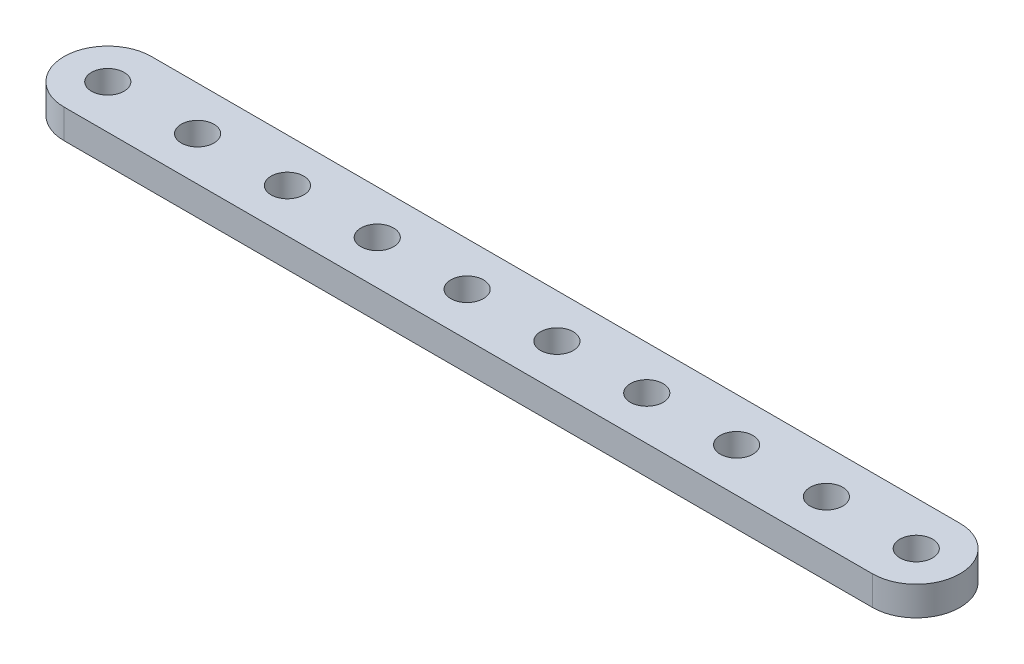
from build123d import *

# Parameters (mm, degrees)
SKETCH1_R           = 1.778
BOSS_EXTRUDE1_DEPTH = 6.35
CUT_EXTRUDE1_DEPTH  = 55.241416026
SKETCH3_W           = 123.961526382
SKETCH3_H           = 57.130094768
CUT_EXTRUDE2_DEPTH  = 3.175


with BuildPart() as part:
    # Sketch1 → Boss-Extrude1 (new body)
    with BuildSketch(Plane.XZ):
        with BuildLine():
            Line((-48.895, -4.7625), (48.895, -4.7625))
            ThreePointArc((48.895, -4.7625), (53.6575, 0), (48.895, 4.7625))
            Line((48.895, 4.7625), (-48.895, 4.7625))
            ThreePointArc((-48.895, 4.7625), (-53.6575, 0), (-48.895, -4.7625))
        make_face()
        with Locations(Location((48.895, 0, 0), (0, 0, 270))):
            Circle(SKETCH1_R, mode=Mode.SUBTRACT)
        with Locations(Location((39.116, 0, 0), (0, 0, 270))):
            Circle(SKETCH1_R, mode=Mode.SUBTRACT)
        with Locations(Location((29.337, 0, 0), (0, 0, 270))):
            Circle(SKETCH1_R, mode=Mode.SUBTRACT)
        with Locations(Location((19.558, 0, 0), (0, 0, 270))):
            Circle(SKETCH1_R, mode=Mode.SUBTRACT)
        with Locations(Location((9.779, 0, 0), (0, 0, 270))):
            Circle(SKETCH1_R, mode=Mode.SUBTRACT)
        with Locations(Location((0, 0, 0), (0, 0, 270))):
            Circle(SKETCH1_R, mode=Mode.SUBTRACT)
        with Locations(Location((-9.779, 0, 0), (0, 0, 270))):
            Circle(SKETCH1_R, mode=Mode.SUBTRACT)
        with Locations(Location((-19.558, 0, 0), (0, 0, 270))):
            Circle(SKETCH1_R, mode=Mode.SUBTRACT)
        with Locations(Location((-29.337, 0, 0), (0, 0, 270))):
            Circle(SKETCH1_R, mode=Mode.SUBTRACT)
        with Locations(Location((-39.116, 0, 0), (0, 0, 270))):
            Circle(SKETCH1_R, mode=Mode.SUBTRACT)
        with Locations(Location((-48.895, 0, 0), (0, 0, 270))):
            Circle(SKETCH1_R, mode=Mode.SUBTRACT)
    extrude(amount=-BOSS_EXTRUDE1_DEPTH)

    # Sketch2 → Cut-Extrude1 (cut, through all)
    with BuildSketch(Plane(origin=(0, 6.35, 0), x_dir=(1, 0, 0), z_dir=(0, 1, 0))):
        with BuildLine():
            Line((-39.116, -4.7625), (-55.615088879, -6.941351058))
            Line((-55.615088879, -6.941351058), (-55.615088879, 8.998214698))
            Line((-55.615088879, 8.998214698), (-39.116, 4.7625))
            ThreePointArc((-39.116, 4.7625), (-43.8785, 0), (-39.116, -4.7625))
        make_face()
    extrude(amount=-CUT_EXTRUDE1_DEPTH, mode=Mode.SUBTRACT)

    # Sketch3 → Cut-Extrude2 (cut)
    with BuildSketch(Plane(origin=(0, 6.35, 0), x_dir=(1, 0, 0), z_dir=(0, 1, 0))):
        with Locations((1.520980261, -5.389631582)):
            Rectangle(SKETCH3_W, SKETCH3_H)
    extrude(amount=-CUT_EXTRUDE2_DEPTH, mode=Mode.SUBTRACT)


solid = part.part
